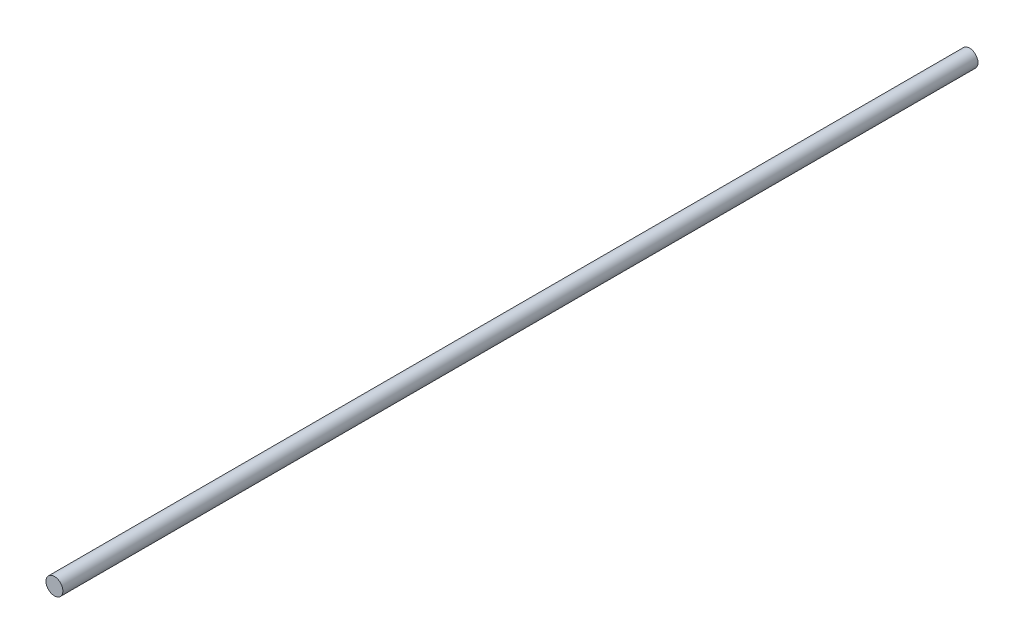
from build123d import *

# Parameters (mm, degrees)
SKETCH1_R           = 2.4
BOSS_EXTRUDE1_DEPTH = 260


with BuildPart() as part:
    # Sketch1 → Boss-Extrude1 (new body)
    with BuildSketch(Plane.XY):
        Circle(SKETCH1_R)
    extrude(amount=BOSS_EXTRUDE1_DEPTH)


solid = part.part
